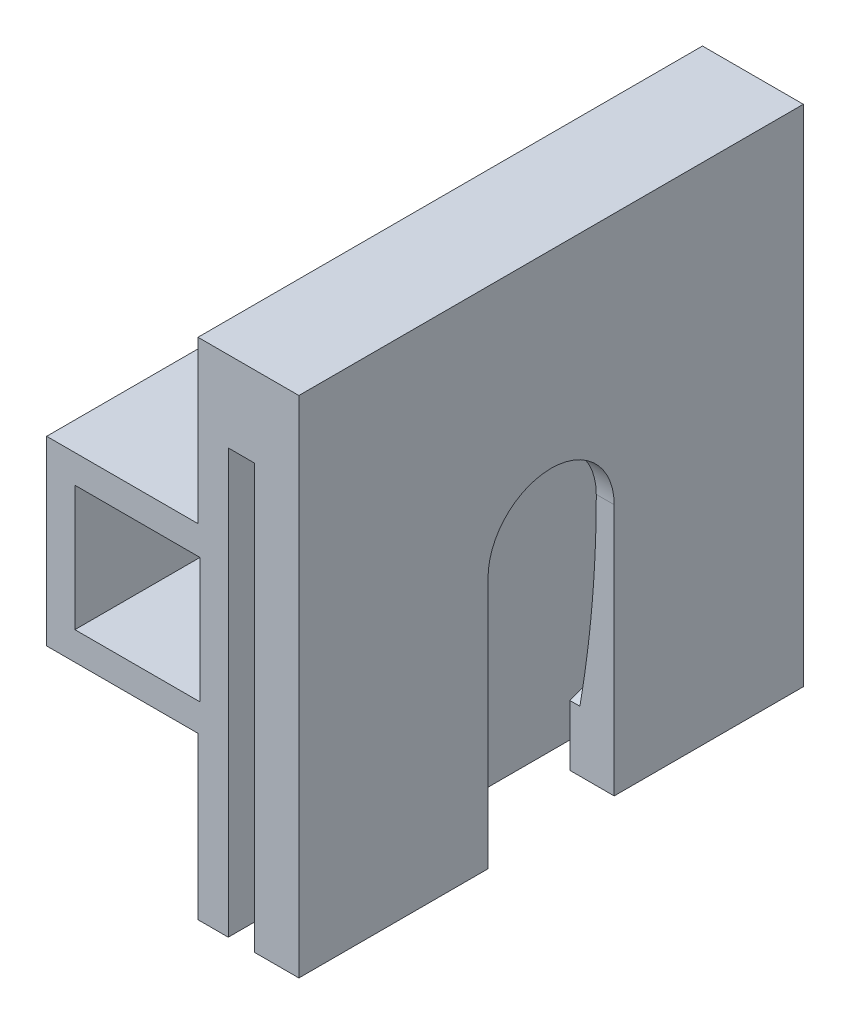
from build123d import *
from build123d.topology import SkipClean

# Parameters (mm, degrees)
SKETCH1_W           = 9
SKETCH1_H           = 9
BOSS_EXTRUDE1_DEPTH = 25
SKETCH2_W           = 6
SKETCH2_H           = 6
CUT_EXTRUDE1_DEPTH  = 26.797286679
SKETCH4_W           = 25
SKETCH4_H           = 25
BOSS_EXTRUDE2_DEPTH = 1.5
SKETCH5_W           = 25
SKETCH5_H           = 25
BOSS_EXTRUDE3_DEPTH = 3.5
SKETCH7_W           = 1.8
SKETCH7_H           = 25
CUT_EXTRUDE5_DEPTH  = 21
CUT_EXTRUDE6_START  = -1.7
CUT_EXTRUDE6_DEPTH  = 1.7
BOSS_EXTRUDE4_START = 0.5
BOSS_EXTRUDE4_DEPTH = 0.5
SKETCH10_W          = 6.2
SKETCH10_H          = 6.2
CUT_EXTRUDE8_DEPTH  = 30.073183548


with BuildPart() as part:
    # Sketch1 → Boss-Extrude1 (new body)
    with BuildSketch(Plane.XY):
        Rectangle(SKETCH1_W, SKETCH1_H)
    extrude(amount=BOSS_EXTRUDE1_DEPTH)

    # Sketch2 → Cut-Extrude1 (cut, through all)
    with BuildSketch(Plane(origin=(0, 0, 0), x_dir=(-1, 0, 0), z_dir=(0, 0, -1))):
        Rectangle(SKETCH2_W, SKETCH2_H)
    extrude(amount=-CUT_EXTRUDE1_DEPTH, mode=Mode.SUBTRACT)

    # Sketch4 → Boss-Extrude2 (add)
    with BuildSketch(Plane(origin=(4.5, 0, 0), x_dir=(0, 0, -1), z_dir=(1, 0, 0))):
        with Locations((-12.5, 0)):
            Rectangle(SKETCH4_W, SKETCH4_H)
    extrude(amount=-BOSS_EXTRUDE2_DEPTH)

    # Sketch5 → Boss-Extrude3 (add)
    with BuildSketch(Plane(origin=(4.5, 0, 0), x_dir=(0, 0, -1), z_dir=(1, 0, 0))):
        with Locations((-12.5, 0)):
            Rectangle(SKETCH5_W, SKETCH5_H)
    extrude(amount=BOSS_EXTRUDE3_DEPTH)

    # Sketch6 → Cut-Revolve2 (revolve, cut)
    with BuildSketch(Plane(origin=(0, 0, 12.5), x_dir=(-1, 0, 0), z_dir=(0, 0, -1)), mode=Mode.PRIVATE) as cut_revolve2_sk:
        with BuildLine():
            Line((-4.5, 10), (-4.5, 0))
            Line((-4.5, 0), (-7.199928584, 0))
            ThreePointArc((-7.199928584, 0), (-6.974492757, 5.020205958), (-6.3, 10))
            Line((-6.3, 10), (-4.5, 10))
        make_face()
    revolve(cut_revolve2_sk.sketch.rotate(Axis((4.575, 0, 12.5), (-1, 0, 0)), 90), axis=Axis((4.575, 0, 12.5), (-1, 0, 0)), mode=Mode.SUBTRACT)

    # Sketch7 → Cut-Extrude5 (cut)
    with BuildSketch(Plane.XZ.offset(12.5)):
        with Locations((5.4, 12.5)):
            Rectangle(SKETCH7_W, SKETCH7_H)
    extrude(amount=-CUT_EXTRUDE5_DEPTH, mode=Mode.SUBTRACT)

    # Sketch8 → Cut-Extrude6 (cut)
    with BuildSketch(Plane(origin=(8, 0, 0), x_dir=(0, 0, -1), z_dir=(1, 0, 0)).offset(CUT_EXTRUDE6_START)):
        with BuildLine():
            Line((-9.375, 0), (-9.375, -12.5))
            ThreePointArc((-9.375, -12.5), (-12.5, -15.625), (-15.625, -12.5))
            Line((-15.625, -12.5), (-15.625, 0))
            ThreePointArc((-15.625, 0), (-12.5, 3.125), (-9.375, 0))
        make_face()
    extrude(amount=CUT_EXTRUDE6_DEPTH, mode=Mode.SUBTRACT)

    # Sketch9 → Boss-Extrude4 (add)
    with SkipClean():  # the faces are left unmerged after this step: merging them gives an invalid solid
        with BuildSketch(Plane.ZY.offset(-6.3).offset(BOSS_EXTRUDE4_START)):
            with BuildLine():
                Line((15.625, -9.499177596), (15.625, -12.5))
                Line((15.625, -12.5), (25, -12.5))
                Line((25, -12.5), (25, 8.5))
                Line((25, 8.5), (17.767826876, 8.5))
                ThreePointArc((17.767826876, 8.5), (22.429878362, -1.182165692), (15.625, -9.499177596))
            make_face()
            with BuildLine():
                Line((0, -12.5), (9.375, -12.5))
                Line((9.375, -12.5), (9.375, -9.499177596))
                ThreePointArc((9.375, -9.499177596), (2.570121638, -1.182165692), (7.232173124, 8.5))
                Line((7.232173124, 8.5), (0, 8.5))
                Line((0, 8.5), (0, -12.5))
            make_face()
        extrude(amount=-BOSS_EXTRUDE4_DEPTH)

    # Sketch10 → Cut-Extrude8 (cut, through all)
    with SkipClean():  # the faces are left unmerged after this step: merging them gives an invalid solid
        with BuildSketch(Plane(origin=(0, 0, 0), x_dir=(-1, 0, 0), z_dir=(0, 0, -1))):
            Rectangle(SKETCH10_W, SKETCH10_H)
        extrude(amount=-CUT_EXTRUDE8_DEPTH, mode=Mode.SUBTRACT)


solid = part.part
